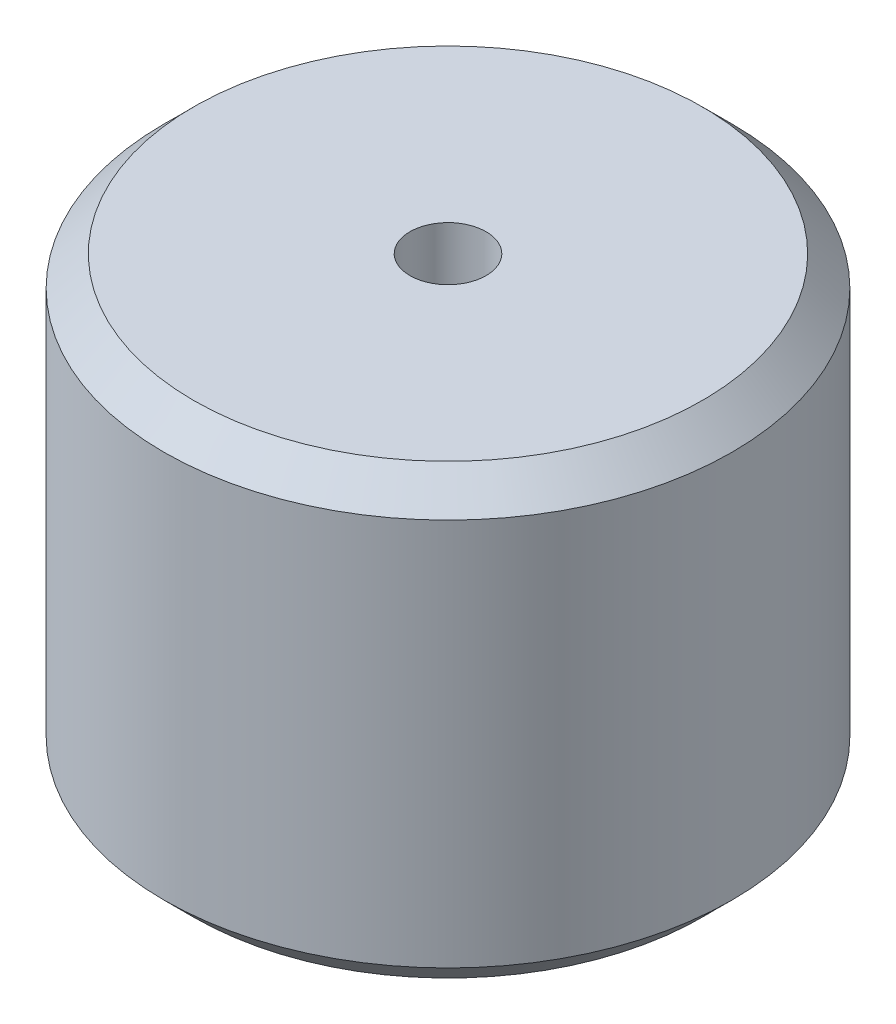
from build123d import *

# Parameters (mm, degrees)
CROQUIS1_R                    = 19.05
SALIENTE_EXTRUIR1_DEPTH       = 30
CHAFL_N1_SIZE                 = 2
TALADRO_ROSCADO_1_4_201_D     = 5.1054
TALADRO_ROSCADO_1_4_201_DEPTH = 25
TALADRO_ROSCADO_1_4_201_TIP   = 1.533816902
CHAFL_N2_SIZE                 = 2


with BuildPart() as part:
    # Croquis1 → Saliente-Extruir1 (new body)
    with BuildSketch(Plane(origin=(0, 0, 0), x_dir=(1, 0, 0), z_dir=(0, 1, 0))):
        with Locations(Location((0, 0, 0), (0, 0, 270))):
            Circle(CROQUIS1_R)
    extrude(amount=SALIENTE_EXTRUIR1_DEPTH)

    # Chaflán1
    chafl_n1_edges = [part.edges().sort_by_distance(p)[0] for p in [
        (0, 30, -19.05),
    ]]
    chamfer(chafl_n1_edges, length=CHAFL_N1_SIZE)

    # Taladro roscado 1/4-201
    with Locations(Plane(origin=(0, 30, 0), x_dir=(1, 0, 0), z_dir=(0, 1, 0))):
        with Locations((0, 0)):
            Hole(TALADRO_ROSCADO_1_4_201_D / 2, depth=TALADRO_ROSCADO_1_4_201_DEPTH)
            with Locations((0, 0, -(TALADRO_ROSCADO_1_4_201_DEPTH + TALADRO_ROSCADO_1_4_201_TIP / 2))):  # 118° drill point
                Cone(0, TALADRO_ROSCADO_1_4_201_D / 2, TALADRO_ROSCADO_1_4_201_TIP, mode=Mode.SUBTRACT)

    # Chaflán2
    chafl_n2_edges = [part.edges().sort_by_distance(p)[0] for p in [
        (0, 0, -19.05),
    ]]
    chamfer(chafl_n2_edges, length=CHAFL_N2_SIZE)


solid = part.part
